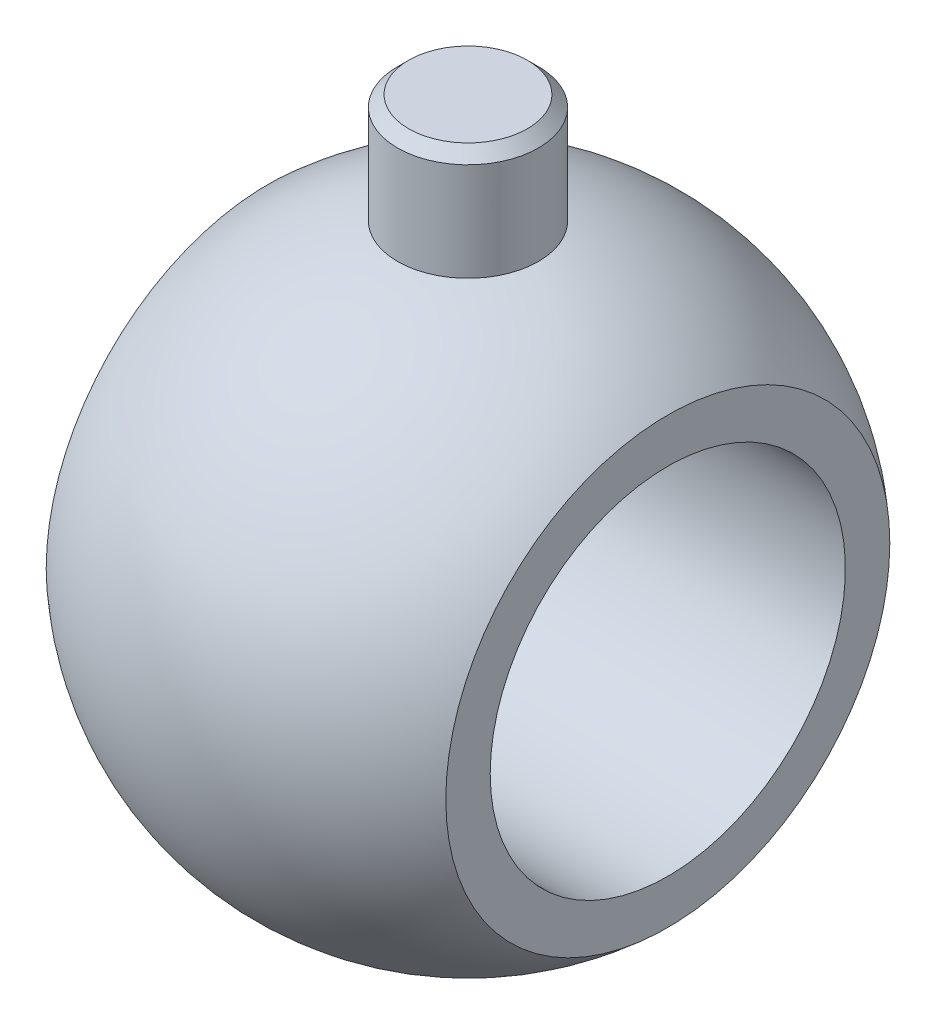
from build123d import *

# Parameters (mm, degrees)
RESSALTO_EXTRUS_O1_REACH      = 37.374
RESSALTO_EXTRUS_O1_END_RADIUS = 13.453624047
ESBO_O2_R                     = 3.175
CHANFRO1_SIZE                 = 0.5


with BuildPart() as part:
    # Esboço1 → Revolução1 (revolve)
    with BuildSketch(Plane.XY, mode=Mode.PRIVATE) as revolu_o1_sk:
        with BuildLine():
            Line((-9, 10), (-9, 8))
            Line((-9, 8), (9, 8))
            Line((9, 8), (9, 10))
            ThreePointArc((9, 10), (0, 13.453624047), (-9, 10))
        make_face()
    revolve(revolu_o1_sk.sketch.rotate(Axis((0, 0, 0), (1, 0, 0)), 90), axis=Axis((0, 0, 0), (1, 0, 0)))

    # Ressalto-extrusão1: up to this sphere (the profile starts outside it)
    ressalto_extrus_o1_end = Location((0, 0, 0)) * Sphere(RESSALTO_EXTRUS_O1_END_RADIUS, mode=Mode.PRIVATE)
    # Esboço2 → Ressalto-extrusão1 (add, up to the surface)
    with BuildSketch(Plane(origin=(0, 18, 0), x_dir=(1, 0, 0), z_dir=(0, 1, 0)), mode=Mode.PRIVATE) as ressalto_extrus_o1_sk1:
        with Locations(Location((0, 0, 0), (0, 0, 270))):
            Circle(ESBO_O2_R)
    ressalto_extrus_o1_tool1 = extrude(ressalto_extrus_o1_sk1.sketch, amount=-RESSALTO_EXTRUS_O1_REACH, mode=Mode.PRIVATE) - ressalto_extrus_o1_end
    add(ressalto_extrus_o1_tool1.solids().sort_by_distance((0, 18, 0))[0])

    # Chanfro1
    chanfro1_edges = [part.edges().sort_by_distance(p)[0] for p in [
        (0, 18, -3.175),
    ]]
    chamfer(chanfro1_edges, length=CHANFRO1_SIZE)


solid = part.part
